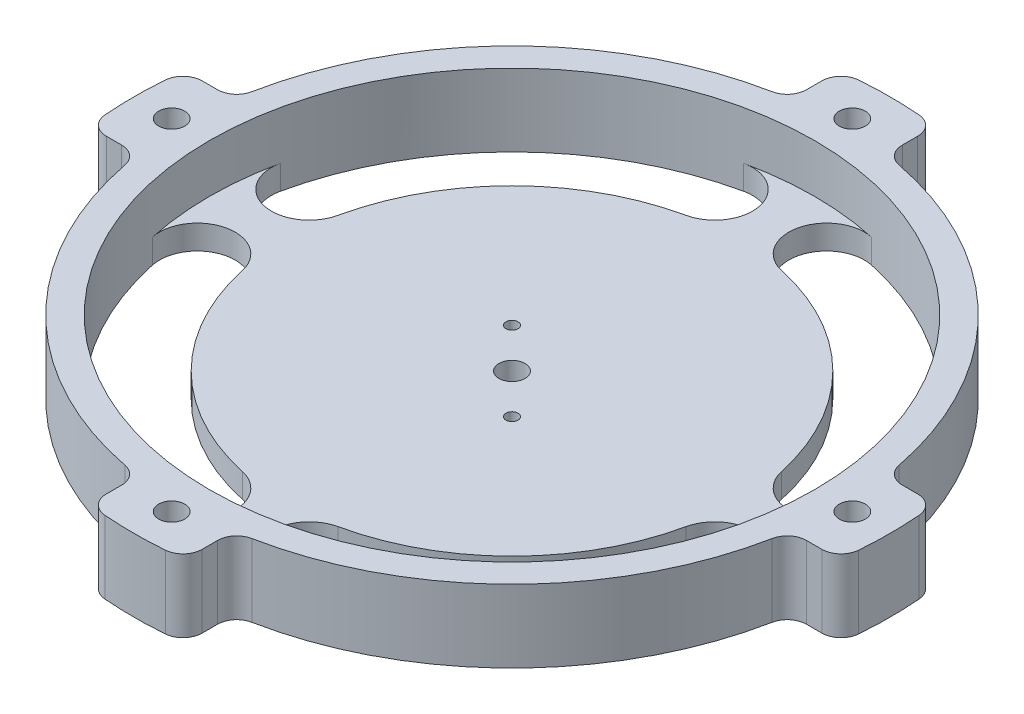
from build123d import *
from build123d.topology import SkipClean

# Parameters (mm, degrees)
CUT_EXTRUDE1_REACH               = 90.75
SKETCH2_R                        = 2
SKETCH2_R_2                      = 1
CUT_EXTRUDE2_REACH               = 90.75
F_18_0_1695_DIAMETER_HOLE1_D     = 4.3053
F_18_0_1695_DIAMETER_HOLE1_DEPTH = 12
CUT_EXTRUDE3_DEPTH               = 28


with BuildPart() as part:
    # Sketch1 → Revolve1 (revolve)
    with BuildSketch(Plane.XY, mode=Mode.PRIVATE) as revolve1_sk:
        Polygon((0, 0), (62.5, 0), (62.5, 12), (50, 12), (50, 4), (0, 4), align=None)
    revolve(revolve1_sk.sketch.rotate(Axis((0, 0, 0), (0, 1, 0)), 90), axis=Axis((0, 0, 0), (0, 1, 0)))

    # Sketch2 → Cut-Extrude1 (cut, up to next)
    with BuildSketch(Plane(origin=(0, 4, 0), x_dir=(1, 0, 0), z_dir=(0, 1, 0)), mode=Mode.PRIVATE) as cut_extrude1_sk1:
        with Locations(Location((0, 0, 0), (0, 0, 270))):
            Circle(SKETCH2_R)
    cut_extrude1_tool1 = extrude(cut_extrude1_sk1.sketch, amount=-CUT_EXTRUDE1_REACH, mode=Mode.PRIVATE) & part.part
    # Sketch2 → Cut-Extrude1 (cut, up to next)
    with BuildSketch(Plane(origin=(0, 4, 0), x_dir=(1, 0, 0), z_dir=(0, 1, 0)), mode=Mode.PRIVATE) as cut_extrude1_sk2:
        with Locations(Location((6.540737726, -6.540737726, 0), (0, 0, 270))):
            Circle(SKETCH2_R_2)
    cut_extrude1_tool2 = extrude(cut_extrude1_sk2.sketch, amount=-CUT_EXTRUDE1_REACH, mode=Mode.PRIVATE) & part.part
    # Sketch2 → Cut-Extrude1 (cut, up to next)
    with BuildSketch(Plane(origin=(0, 4, 0), x_dir=(1, 0, 0), z_dir=(0, 1, 0)), mode=Mode.PRIVATE) as cut_extrude1_sk3:
        with Locations(Location((-6.540737726, 6.540737726, 0), (0, 0, 270))):
            Circle(SKETCH2_R_2)
    cut_extrude1_tool3 = extrude(cut_extrude1_sk3.sketch, amount=-CUT_EXTRUDE1_REACH, mode=Mode.PRIVATE) & part.part
    add(cut_extrude1_tool1.solids().sort_by_distance((0, 4, 0))[0], mode=Mode.SUBTRACT)
    add(cut_extrude1_tool2.solids().sort_by_distance((6.540738, 4, 6.540738))[0], mode=Mode.SUBTRACT)
    add(cut_extrude1_tool3.solids().sort_by_distance((-6.540738, 4, -6.540738))[0], mode=Mode.SUBTRACT)

    # Sketch3 → Cut-Extrude2 (cut, up to next)
    with BuildSketch(Plane(origin=(0, 4, 0), x_dir=(1, 0, 0), z_dir=(0, 1, 0)), mode=Mode.PRIVATE) as cut_extrude2_sk1:
        with BuildLine():
            ThreePointArc((48.869672579, 10.571428571), (35.355339059, 35.355339059), (10.571428571, 48.869672579))
            ThreePointArc((10.571428571, 48.869672579), (3.141290928, 44.082392078), (7.928571429, 36.652254434))
            ThreePointArc((7.928571429, 36.652254434), (26.516504294, 26.516504294), (36.652254434, 7.928571429))
            ThreePointArc((36.652254434, 7.928571429), (44.082392078, 3.141290928), (48.869672579, 10.571428571))
        make_face()
    cut_extrude2_tool1 = extrude(cut_extrude2_sk1.sketch, amount=-CUT_EXTRUDE2_REACH, mode=Mode.PRIVATE) & part.part
    # Sketch3 → Cut-Extrude2 (cut, up to next)
    with BuildSketch(Plane(origin=(0, 4, 0), x_dir=(1, 0, 0), z_dir=(0, 1, 0)), mode=Mode.PRIVATE) as cut_extrude2_sk2:
        with BuildLine():
            ThreePointArc((-48.869672579, 10.571428571), (-35.355339059, 35.355339059), (-10.571428571, 48.869672579))
            ThreePointArc((-10.571428571, 48.869672579), (-3.141290928, 44.082392078), (-7.928571429, 36.652254434))
            ThreePointArc((-7.928571429, 36.652254434), (-26.516504294, 26.516504294), (-36.652254434, 7.928571429))
            ThreePointArc((-36.652254434, 7.928571429), (-44.082392078, 3.141290928), (-48.869672579, 10.571428571))
        make_face()
    cut_extrude2_tool2 = extrude(cut_extrude2_sk2.sketch, amount=-CUT_EXTRUDE2_REACH, mode=Mode.PRIVATE) & part.part
    # Sketch3 → Cut-Extrude2 (cut, up to next)
    with BuildSketch(Plane(origin=(0, 4, 0), x_dir=(1, 0, 0), z_dir=(0, 1, 0)), mode=Mode.PRIVATE) as cut_extrude2_sk3:
        with BuildLine():
            ThreePointArc((48.869672579, -10.571428571), (35.355339059, -35.355339059), (10.571428571, -48.869672579))
            ThreePointArc((10.571428571, -48.869672579), (3.141290928, -44.082392078), (7.928571429, -36.652254434))
            ThreePointArc((7.928571429, -36.652254434), (26.516504294, -26.516504294), (36.652254434, -7.928571429))
            ThreePointArc((36.652254434, -7.928571429), (44.082392078, -3.141290928), (48.869672579, -10.571428571))
        make_face()
    cut_extrude2_tool3 = extrude(cut_extrude2_sk3.sketch, amount=-CUT_EXTRUDE2_REACH, mode=Mode.PRIVATE) & part.part
    # Sketch3 → Cut-Extrude2 (cut, up to next)
    with BuildSketch(Plane(origin=(0, 4, 0), x_dir=(1, 0, 0), z_dir=(0, 1, 0)), mode=Mode.PRIVATE) as cut_extrude2_sk4:
        with BuildLine():
            ThreePointArc((-48.869672579, -10.571428571), (-35.355339059, -35.355339059), (-10.571428571, -48.869672579))
            ThreePointArc((-10.571428571, -48.869672579), (-3.141290928, -44.082392078), (-7.928571429, -36.652254434))
            ThreePointArc((-7.928571429, -36.652254434), (-26.516504294, -26.516504294), (-36.652254434, -7.928571429))
            ThreePointArc((-36.652254434, -7.928571429), (-44.082392078, -3.141290928), (-48.869672579, -10.571428571))
        make_face()
    cut_extrude2_tool4 = extrude(cut_extrude2_sk4.sketch, amount=-CUT_EXTRUDE2_REACH, mode=Mode.PRIVATE) & part.part
    add(cut_extrude2_tool1.solids().sort_by_distance((28.738526, 4, -28.738526))[0], mode=Mode.SUBTRACT)
    add(cut_extrude2_tool2.solids().sort_by_distance((-28.738526, 4, -28.738526))[0], mode=Mode.SUBTRACT)
    add(cut_extrude2_tool3.solids().sort_by_distance((28.738526, 4, 28.738526))[0], mode=Mode.SUBTRACT)
    add(cut_extrude2_tool4.solids().sort_by_distance((-28.738526, 4, 28.738526))[0], mode=Mode.SUBTRACT)

    # #18 (0.1695) Diameter Hole1
    with Locations(Plane(origin=(0, 12, 0), x_dir=(1, 0, 0), z_dir=(0, 1, 0))):
        with Locations((0, 56.25), (56.25, 0), (0, -56.25), (-56.25, 0), (0, 0)):
            Hole(F_18_0_1695_DIAMETER_HOLE1_D / 2, depth=F_18_0_1695_DIAMETER_HOLE1_DEPTH)

    # Sketch6 → Cut-Extrude3 (cut)
    with SkipClean():  # the faces are left unmerged after this step: merging them gives an invalid solid
        with BuildSketch(Plane(origin=(0, 19.982495649, 0), x_dir=(1, 0, 0), z_dir=(0, 1, 0))):
            with BuildLine():
                Line((-56.597564395, 7.921), (-59.13485528, 7.921))
                ThreePointArc((-59.13485528, 7.921), (-61.28824505, 7.07913898), (-62.299678972, 5))
                ThreePointArc((-62.299678972, 5), (-44.194173824, 44.194173824), (-5, 62.299678972))
                ThreePointArc((-5, 62.299678972), (-7.07913898, 61.28824505), (-7.921, 59.13485528))
                Line((-7.921, 59.13485528), (-7.921, 56.597564395))
                ThreePointArc((-7.921, 56.597564395), (-8.64446813, 54.579988512), (-10.485166883, 53.48187801))
                ThreePointArc((-10.485166883, 53.48187801), (-38.537319575, 38.537319575), (-53.48187801, 10.485166883))
                ThreePointArc((-53.48187801, 10.485166883), (-54.579988512, 8.64446813), (-56.597564395, 7.921))
            make_face()
            with BuildLine():
                Line((7.921, 56.597564395), (7.921, 59.13485528))
                ThreePointArc((7.921, 59.13485528), (7.07913898, 61.28824505), (5, 62.299678972))
                ThreePointArc((5, 62.299678972), (44.194173824, 44.194173824), (62.299678972, 5))
                ThreePointArc((62.299678972, 5), (61.28824505, 7.07913898), (59.13485528, 7.921))
                Line((59.13485528, 7.921), (56.597564395, 7.921))
                ThreePointArc((56.597564395, 7.921), (54.579988512, 8.64446813), (53.48187801, 10.485166883))
                ThreePointArc((53.48187801, 10.485166883), (38.537319575, 38.537319575), (10.485166883, 53.48187801))
                ThreePointArc((10.485166883, 53.48187801), (8.64446813, 54.579988512), (7.921, 56.597564395))
            make_face()
            with BuildLine():
                Line((56.597564395, -7.921), (59.13485528, -7.921))
                ThreePointArc((59.13485528, -7.921), (61.28824505, -7.07913898), (62.299678972, -5))
                ThreePointArc((62.299678972, -5), (44.194173824, -44.194173824), (5, -62.299678972))
                ThreePointArc((5, -62.299678972), (7.07913898, -61.28824505), (7.921, -59.13485528))
                Line((7.921, -59.13485528), (7.921, -56.597564395))
                ThreePointArc((7.921, -56.597564395), (8.64446813, -54.579988512), (10.485166883, -53.48187801))
                ThreePointArc((10.485166883, -53.48187801), (38.537319575, -38.537319575), (53.48187801, -10.485166883))
                ThreePointArc((53.48187801, -10.485166883), (54.579988512, -8.64446813), (56.597564395, -7.921))
            make_face()
            with BuildLine():
                Line((-7.921, -56.597564395), (-7.921, -59.13485528))
                ThreePointArc((-7.921, -59.13485528), (-7.07913898, -61.28824505), (-5, -62.299678972))
                ThreePointArc((-5, -62.299678972), (-44.194173824, -44.194173824), (-62.299678972, -5))
                ThreePointArc((-62.299678972, -5), (-61.28824505, -7.07913898), (-59.13485528, -7.921))
                Line((-59.13485528, -7.921), (-56.597564395, -7.921))
                ThreePointArc((-56.597564395, -7.921), (-54.579988512, -8.64446813), (-53.48187801, -10.485166883))
                ThreePointArc((-53.48187801, -10.485166883), (-38.537319575, -38.537319575), (-10.485166883, -53.48187801))
                ThreePointArc((-10.485166883, -53.48187801), (-8.64446813, -54.579988512), (-7.921, -56.597564395))
            make_face()
        extrude(amount=-CUT_EXTRUDE3_DEPTH, mode=Mode.SUBTRACT)


solid = part.part
